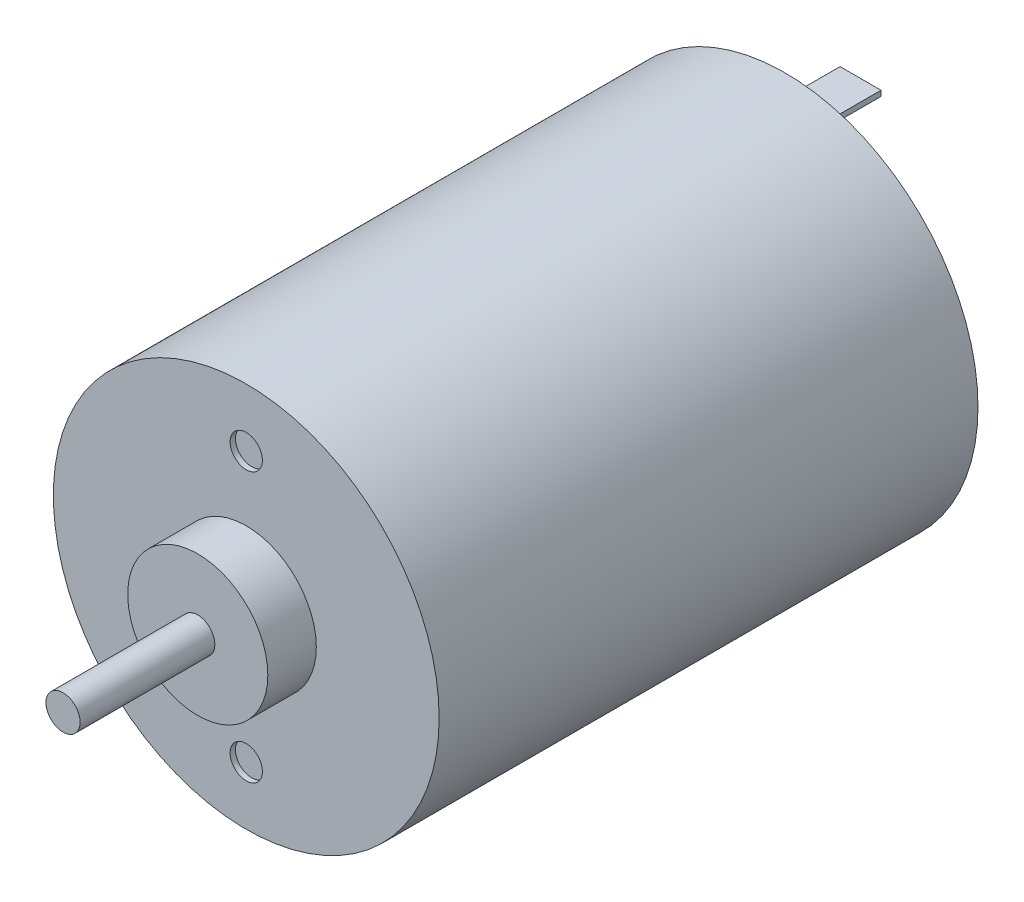
from build123d import *

# Parameters (mm, degrees)
SKETCH_2_R          = 17.9
EXTRUDE_1_DEPTH     = 50
SKETCH_3_R          = 6.5
EXTRUDE_2_DEPTH     = 4.5
SKETCH_4_R          = 1.585
EXTRUDE_5_DEPTH     = 12.5
SKETCH_5_R          = 1.5
CUT_EXTRUDE_1_DEPTH = 0.5
SKETCH_6_W          = 3.8
SKETCH_6_H          = 0.5
EXTRUDE_6_DEPTH     = 7


with BuildPart() as part:
    # ｽｹｯﾁ2 → ﾎﾞｽ - 押し出し1 (new body)
    with BuildSketch(Plane.XY):
        Circle(SKETCH_2_R)
    extrude(amount=EXTRUDE_1_DEPTH)

    # ｽｹｯﾁ3 → ﾎﾞｽ - 押し出し2 (add)
    with BuildSketch(Plane.XY.offset(50)):
        Circle(SKETCH_3_R)
    extrude(amount=EXTRUDE_2_DEPTH)

    # ｽｹｯﾁ4 → ﾎﾞｽ - 押し出し5 (add)
    with BuildSketch(Plane.XY.offset(54.5)):
        Circle(SKETCH_4_R)
    extrude(amount=EXTRUDE_5_DEPTH)

    # ｽｹｯﾁ5 → ｶｯﾄ - 押し出し1 (cut)
    with BuildSketch(Plane.XY.offset(50)):
        with Locations((0, 12.5)):
            Circle(SKETCH_5_R)
        with Locations((0, -12.5)):
            Circle(SKETCH_5_R)
    extrude(amount=-CUT_EXTRUDE_1_DEPTH, mode=Mode.SUBTRACT)

    # ｽｹｯﾁ6 → ﾎﾞｽ - 押し出し6 (add)
    with BuildSketch(Plane(origin=(0, 0, 0), x_dir=(-1, 0, 0), z_dir=(0, 0, -1))):
        with Locations((0, 13.7)):
            Rectangle(SKETCH_6_W, SKETCH_6_H)
        with Locations((0, -13.7)):
            Rectangle(SKETCH_6_W, SKETCH_6_H)
    extrude(amount=EXTRUDE_6_DEPTH)


solid = part.part
